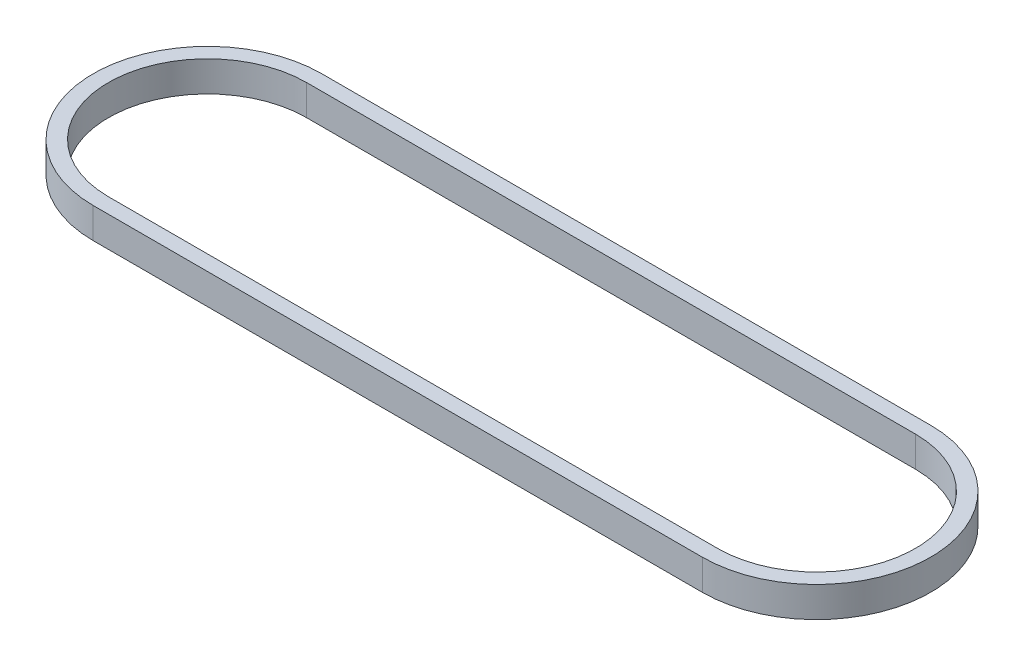
from build123d import *

# Parameters (mm, degrees)
BOSS_EXTRUDE1_DEPTH = 4


with BuildPart() as part:
    # Sketch1 → Boss-Extrude1 (new body)
    with BuildSketch(Plane(origin=(0, 0, 0), x_dir=(1, 0, 0), z_dir=(0, 1, 0))):
        with BuildLine():
            Line((-40, 15), (40, 15))
            ThreePointArc((40, 15), (55, 0), (40, -15))
            Line((40, -15), (-40, -15))
            ThreePointArc((-40, -15), (-55, 0), (-40, 15))
        make_face()
        with BuildLine():
            Line((-40, 13), (40, 13))
            ThreePointArc((40, 13), (53, 0), (40, -13))
            Line((40, -13), (-40, -13))
            ThreePointArc((-40, -13), (-53, 0), (-40, 13))
        make_face(mode=Mode.SUBTRACT)
    extrude(amount=BOSS_EXTRUDE1_DEPTH)


solid = part.part
